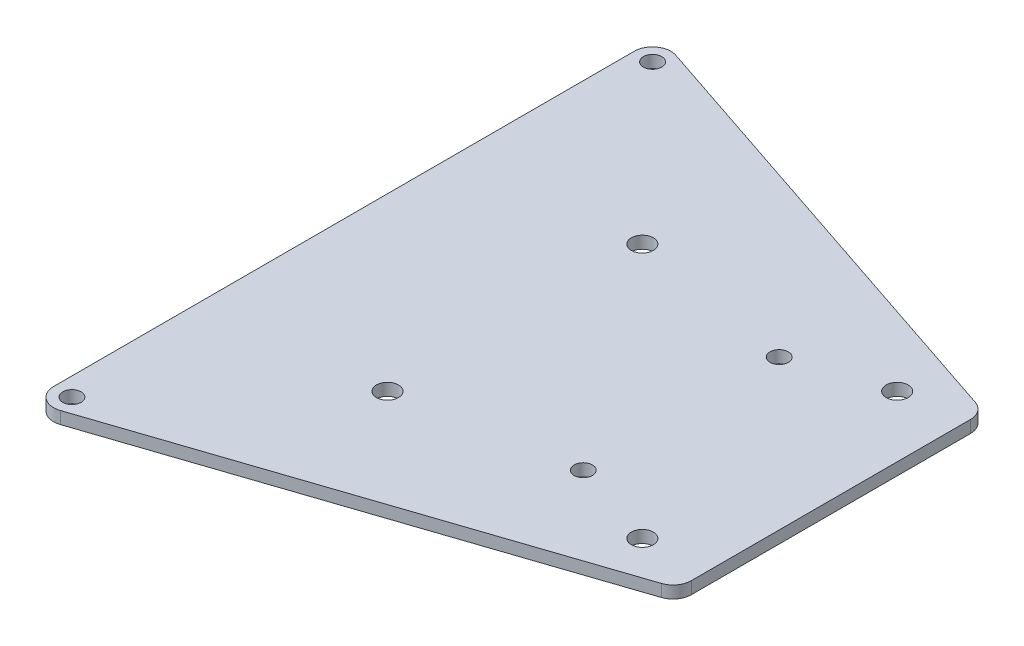
from build123d import *

# Parameters (mm, degrees)
CROQUIS1_R              = 1.8
CROQUIS1_R_2            = 1.5
SALIENTE_EXTRUIR1_DEPTH = 2


with BuildPart() as part:
    # Croquis1 → Saliente-Extruir1 (new body)
    with BuildSketch(Plane(origin=(0, 0, 0), x_dir=(1, 0, 0), z_dir=(0, 1, 0))):
        with BuildLine():
            Line((0.952532669, 2.844763877), (74.672532669, -21.839431846))
            ThreePointArc((74.672532669, -21.839431846), (76.154912525, -22.931711487), (76.72, -24.684195722))
            Line((76.72, -24.684195722), (76.72, -70.365804278))
            ThreePointArc((76.72, -70.365804278), (76.154912525, -72.118288513), (74.672532669, -73.210568154))
            Line((74.672532669, -73.210568154), (0.952532669, -97.894763877))
            ThreePointArc((0.952532669, -97.894763877), (-1.752484236, -97.484912525), (-3, -95.05))
            Line((-3, -95.05), (-3, 0))
            ThreePointArc((-3, 0), (-1.752484236, 2.434912525), (0.952532669, 2.844763877))
        make_face()
        with Locations(Location((25, -26.675, 0), (0, 0, 270))):
            Circle(CROQUIS1_R, mode=Mode.SUBTRACT)
        with Locations(Location((25, -68.395, 0), (0, 0, 270))):
            Circle(CROQUIS1_R, mode=Mode.SUBTRACT)
        with Locations(Location((66.72, -26.675, 0), (0, 0, 270))):
            Circle(CROQUIS1_R, mode=Mode.SUBTRACT)
        with Locations(Location((66.72, -68.395, 0), (0, 0, 270))):
            Circle(CROQUIS1_R, mode=Mode.SUBTRACT)
        with Locations(Location((0, 0, 0), (0, 0, 270))):
            Circle(CROQUIS1_R_2, mode=Mode.SUBTRACT)
        with Locations(Location((0, -95.05, 0), (0, 0, 270))):
            Circle(CROQUIS1_R_2, mode=Mode.SUBTRACT)
        with Locations(Location((52.22, -31.49, 0), (0, 0, 270))):
            Circle(CROQUIS1_R_2, mode=Mode.SUBTRACT)
        with Locations(Location((52.22, -63.56, 0), (0, 0, 270))):
            Circle(CROQUIS1_R_2, mode=Mode.SUBTRACT)
    extrude(amount=SALIENTE_EXTRUIR1_DEPTH)


solid = part.part
